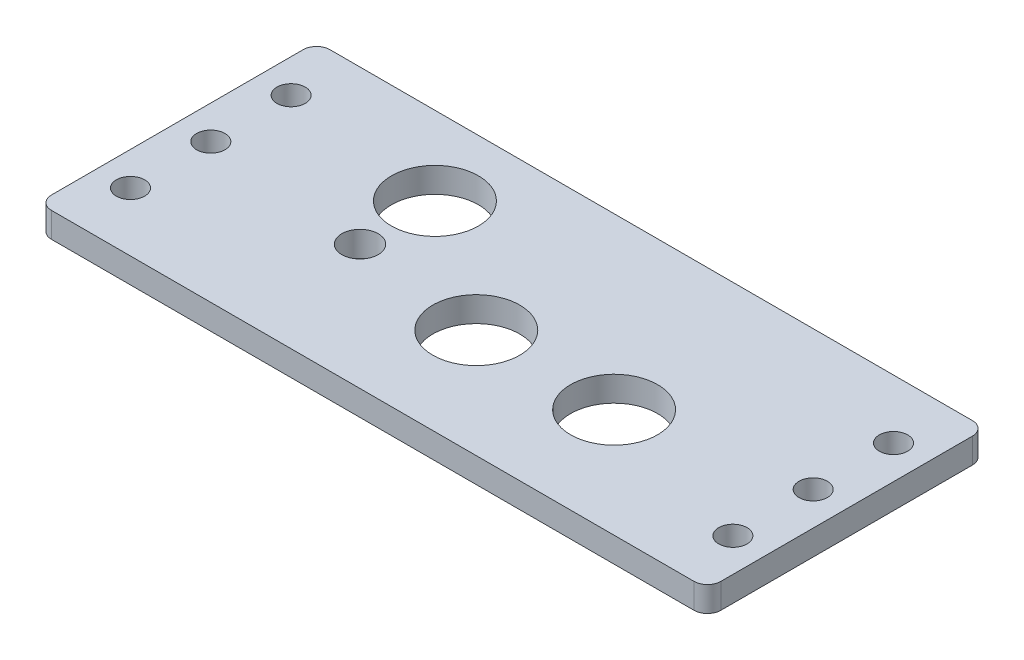
from build123d import *

# Parameters (mm, degrees)
SKETCH1_W           = 127
SKETCH1_H           = 52.832
BOSS_EXTRUDE1_DEPTH = 4.7625
FILLET1_R           = 2.54
SKETCH2_R           = 2.69
CUT_EXTRUDE1_DEPTH  = 69.940093286
SKETCH3_R           = 8.250000011
CUT_EXTRUDE2_DEPTH  = 69.940093286
SKETCH4_R           = 8.255000001
SKETCH4_R_2         = 3.450513254
CUT_EXTRUDE3_DEPTH  = 69.940093286


with BuildPart() as part:
    # Sketch1 → Boss-Extrude1 (new body)
    with BuildSketch(Plane(origin=(0, 0, 0), x_dir=(1, 0, 0), z_dir=(0, 1, 0))):
        Rectangle(SKETCH1_W, SKETCH1_H)
    extrude(amount=BOSS_EXTRUDE1_DEPTH)

    # Fillet1
    fillet1_edges = [part.edges().sort_by_distance(p)[0] for p in [
        (63.5, 2.38125, 26.416),
        (-63.5, 2.38125, 26.416),
        (-63.5, 2.38125, -26.416),
        (63.5, 2.38125, -26.416),
    ]]
    fillet(fillet1_edges, radius=FILLET1_R)

    # Sketch2 → Cut-Extrude1 (cut, through all)
    with BuildSketch(Plane.XZ):
        with Locations(Location((57.15, -15.24, 0), (0, 0, 270))):
            Circle(SKETCH2_R)
        with Locations(Location((57.15, 0, 0), (0, 0, 270))):
            Circle(SKETCH2_R)
        with Locations(Location((57.15, 15.24, 0), (0, 0, 270))):
            Circle(SKETCH2_R)
    cut_extrude1 = extrude(amount=-CUT_EXTRUDE1_DEPTH, mode=Mode.SUBTRACT)

    # Mirror1: Cut-Extrude1 across plane
    add(cut_extrude1.mirror(Plane(origin=(0, 0, 0), x_dir=(0, 0, 1), z_dir=(1, 0, 0))), mode=Mode.SUBTRACT)

    # Sketch3 → Cut-Extrude2 (cut, through all)
    with BuildSketch(Plane(origin=(0, 4.7625, 0), x_dir=(1, 0, 0), z_dir=(0, 1, 0))):
        with Locations(Location((25.164289669, -5.7912, 0), (0, 0, 270))):
            Circle(SKETCH3_R)
        with Locations(Location((-0.985710355, -5.7912, 0), (0, 0, 270))):
            Circle(SKETCH3_R)
    extrude(amount=-CUT_EXTRUDE2_DEPTH, mode=Mode.SUBTRACT)

    # Sketch4 → Cut-Extrude3 (cut, through all)
    with BuildSketch(Plane(origin=(0, 4.7625, 0), x_dir=(1, 0, 0), z_dir=(0, 1, 0))):
        with Locations(Location((-26.143710331, 11.522643822, 0), (0, 0, 270))):
            Circle(SKETCH4_R)
        with Locations(Location((-26.143710331, -2.695896838, 0), (0, 0, 270))):
            Circle(SKETCH4_R_2)
    extrude(amount=-CUT_EXTRUDE3_DEPTH, mode=Mode.SUBTRACT)


solid = part.part
